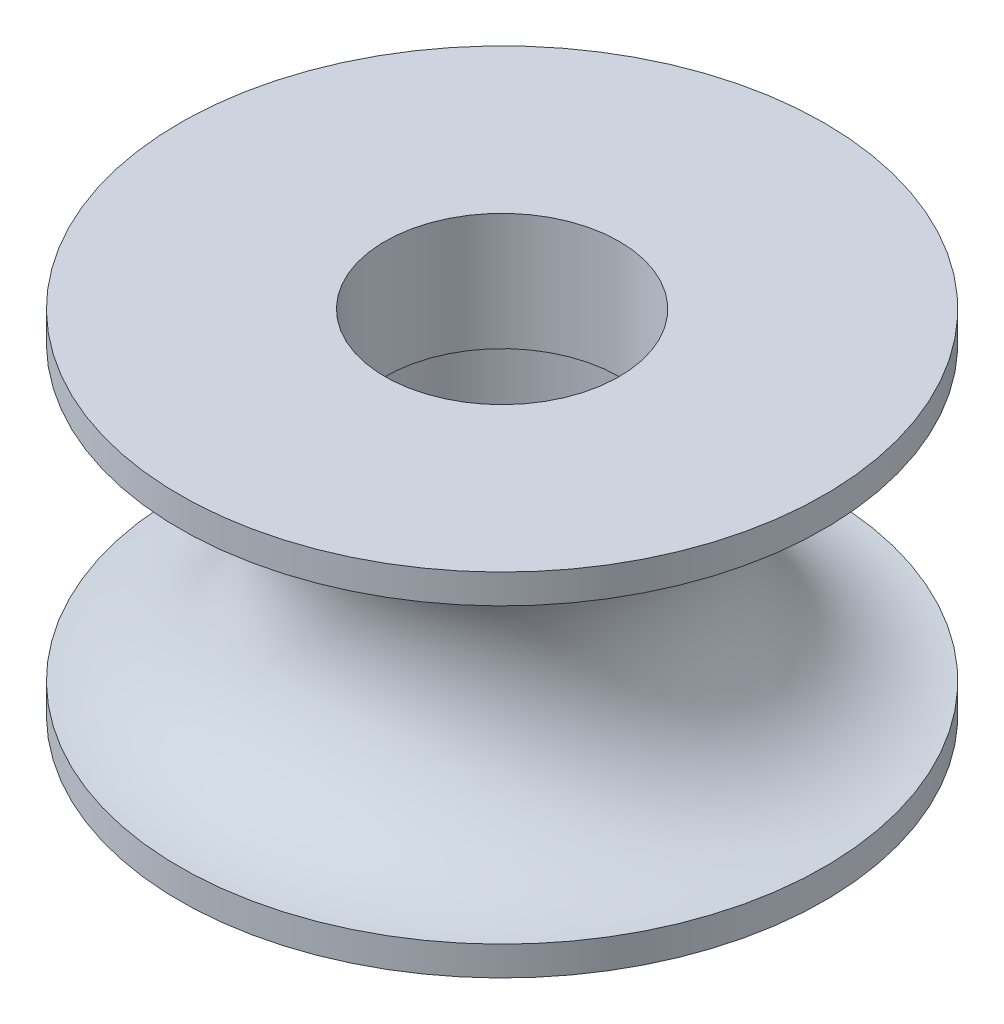
from build123d import *

# Parameters (mm, degrees)
SKETCH_9_W          = 1
SKETCH_9_H          = 4
SKETCH_10_R         = 5.1
CUT_EXTRUDE_2_DEPTH = 8


with BuildPart() as part:
    # 草图7 → 旋转1 (revolve)
    with BuildSketch(Plane.XY, mode=Mode.PRIVATE) as revolve_1_sk:
        with BuildLine():
            Line((-5, 5), (-5, -5))
            Line((-5, -5), (-5, -6))
            Line((-5, -6), (-11, -6))
            Line((-11, -6), (-11, -5))
            ThreePointArc((-11, -5), (-6, 0), (-11, 5))
            Line((-11, 5), (-11, 6))
            Line((-11, 6), (-5, 6))
            Line((-5, 6), (-5, 5))
        make_face()
    revolve(revolve_1_sk.sketch.rotate(Axis((0, 0, 0), (0, 1, 0)), 270), axis=Axis((0, 0, 0), (0, 1, 0)))

    # 草图9 → 旋转2 (revolve)
    with BuildSketch(Plane.XY, mode=Mode.PRIVATE) as revolve_2_sk:
        with Locations((-4.5, 4)):
            Rectangle(SKETCH_9_W, SKETCH_9_H)
        with Locations((-4.5, -4)):
            Rectangle(SKETCH_9_W, SKETCH_9_H)
    revolve(revolve_2_sk.sketch.rotate(Axis((0, 0, 0), (0, 1, 0)), 270), axis=Axis((0, 0, 0), (0, 1, 0)))

    # 草图10 → 切除-拉伸2 (cut)
    with BuildSketch(Plane.XZ.offset(6)):
        with Locations(Location((0, 0, 0), (0, 0, 270))):
            Circle(SKETCH_10_R)
    extrude(amount=-CUT_EXTRUDE_2_DEPTH, mode=Mode.SUBTRACT)


solid = part.part
